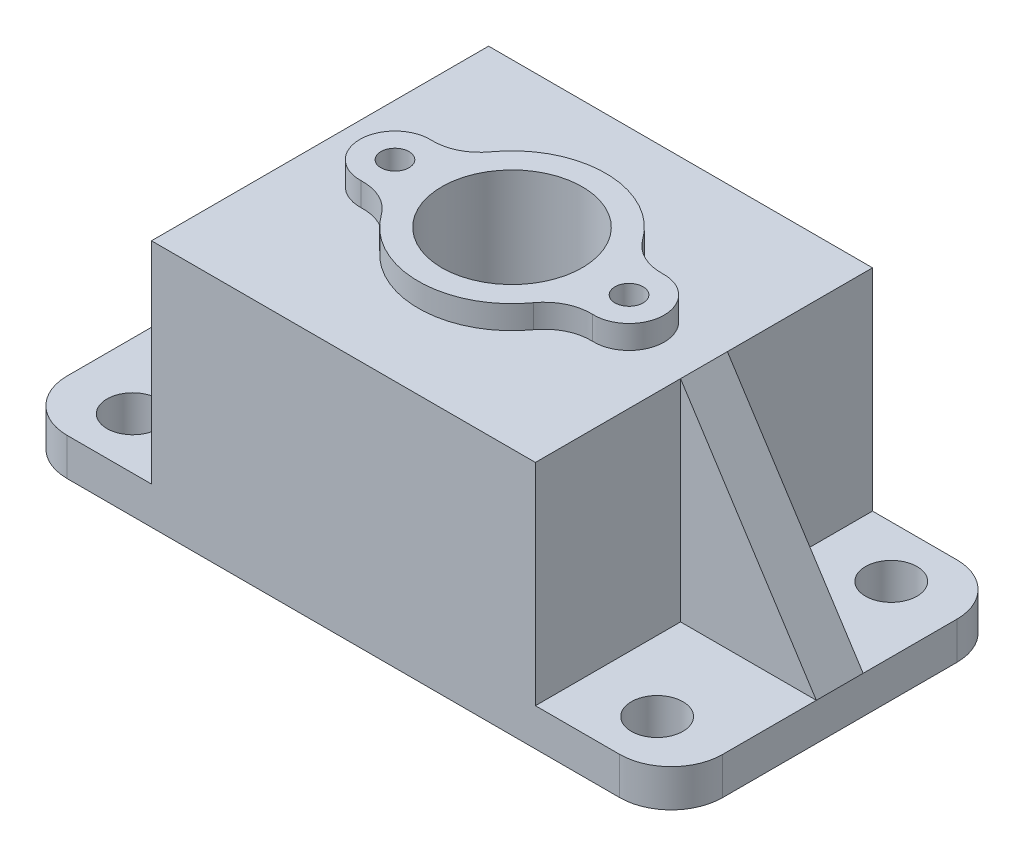
from build123d import *

# Parameters (mm, degrees)
SKETCH2_R           = 5.5
BOSS_EXTRUDE1_DEPTH = 8
SKETCH6_W           = 82
SKETCH6_H           = 72
BOSS_EXTRUDE4_DEPTH = 45
BOSS_EXTRUDE5_DEPTH = 5
CUT_EXTRUDE1_DEPTH  = 35
FILLET1_R           = 6
SKETCH9_R           = 15
SKETCH9_R_2         = 3
CUT_EXTRUDE2_DEPTH  = 98.775252493
RIB2_REACH          = 99.775
SKETCH11_WALL_W     = 251.085540362
SKETCH11_WALL_H     = 10


with BuildPart() as part:
    # Sketch2 → Boss-Extrude1 (new body)
    with BuildSketch(Plane(origin=(0, 0, 0), x_dir=(1, 0, 0), z_dir=(0, 1, 0))):
        with BuildLine():
            Line((-59, -36), (59, -36))
            ThreePointArc((59, -36), (66.778174593, -32.778174593), (70, -25))
            Line((70, -25), (70, 25))
            ThreePointArc((70, 25), (66.778174593, 32.778174593), (59, 36))
            Line((59, 36), (-59, 36))
            ThreePointArc((-59, 36), (-66.778174593, 32.778174593), (-70, 25))
            Line((-70, 25), (-70, -25))
            ThreePointArc((-70, -25), (-66.778174593, -32.778174593), (-59, -36))
        make_face()
        with Locations(Location((-56, 25, 0), (0, 0, 270))):
            Circle(SKETCH2_R, mode=Mode.SUBTRACT)
        with Locations(Location((-56, -25, 0), (0, 0, 270))):
            Circle(SKETCH2_R, mode=Mode.SUBTRACT)
        with Locations(Location((56, 25, 0), (0, 0, 270))):
            Circle(SKETCH2_R, mode=Mode.SUBTRACT)
        with Locations(Location((56, -25, 0), (0, 0, 270))):
            Circle(SKETCH2_R, mode=Mode.SUBTRACT)
    extrude(amount=BOSS_EXTRUDE1_DEPTH)

    # Sketch6 → Boss-Extrude4 (add)
    with BuildSketch(Plane(origin=(0, 8, 0), x_dir=(1, 0, 0), z_dir=(0, 1, 0))):
        Rectangle(SKETCH6_W, SKETCH6_H)
    extrude(amount=BOSS_EXTRUDE4_DEPTH)

    # Sketch7 → Boss-Extrude5 (add)
    with BuildSketch(Plane(origin=(0, 53, 0), x_dir=(1, 0, 0), z_dir=(0, 1, 0))):
        with BuildLine():
            ThreePointArc((-16.25, -11.659223816), (0, -20), (16.25, -11.659223816))
            ThreePointArc((16.25, -11.659223816), (19.968227615, -8.512179491), (24.732142857, -7.495215311))
            ThreePointArc((24.732142857, -7.495215311), (32.5, 0), (24.732142857, 7.495215311))
            ThreePointArc((24.732142857, 7.495215311), (19.968227615, 8.512179491), (16.25, 11.659223816))
            ThreePointArc((16.25, 11.659223816), (0, 20), (-16.25, 11.659223816))
            ThreePointArc((-16.25, 11.659223816), (-19.968227615, 8.512179491), (-24.732142857, 7.495215311))
            ThreePointArc((-24.732142857, 7.495215311), (-32.5, 0), (-24.732142857, -7.495215311))
            ThreePointArc((-24.732142857, -7.495215311), (-19.968227615, -8.512179491), (-16.25, -11.659223816))
        make_face()
    extrude(amount=BOSS_EXTRUDE5_DEPTH)

    # Sketch8 → Cut-Extrude1 (cut)
    with BuildSketch(Plane.XZ):
        with BuildLine():
            Line((-26.5, -31.5), (26.5, -31.5))
            ThreePointArc((26.5, -31.5), (30.742640687, -29.742640687), (32.5, -25.5))
            Line((32.5, -25.5), (32.5, 25.5))
            ThreePointArc((32.5, 25.5), (30.742640687, 29.742640687), (26.5, 31.5))
            Line((26.5, 31.5), (-26.5, 31.5))
            ThreePointArc((-26.5, 31.5), (-30.742640687, 29.742640687), (-32.5, 25.5))
            Line((-32.5, 25.5), (-32.5, -25.5))
            ThreePointArc((-32.5, -25.5), (-30.742640687, -29.742640687), (-26.5, -31.5))
        make_face()
    extrude(amount=-CUT_EXTRUDE1_DEPTH, mode=Mode.SUBTRACT)

    # Fillet1
    fillet1_edges = [part.edges().sort_by_distance(p)[0] for p in [
        (-30.742640687, 35, -29.742640687),
        (-32.5, 35, 0),
        (-30.742640687, 35, 29.742640687),
        (0, 35, 31.5),
        (30.742640687, 35, 29.742640687),
        (32.5, 35, 0),
        (30.742640687, 35, -29.742640687),
        (0, 35, -31.5),
    ]]
    fillet(fillet1_edges, radius=FILLET1_R)

    # Sketch9 → Cut-Extrude2 (cut, through all)
    with BuildSketch(Plane(origin=(0, 58, 0), x_dir=(1, 0, 0), z_dir=(0, 1, 0))):
        with Locations(Location((0, 0, 0), (0, 0, 270))):
            Circle(SKETCH9_R)
        with Locations(Location((25, 0, 0), (0, 0, 270))):
            Circle(SKETCH9_R_2)
        with Locations(Location((-25, 0, 0), (0, 0, 270))):
            Circle(SKETCH9_R_2)
    extrude(amount=-CUT_EXTRUDE2_DEPTH, mode=Mode.SUBTRACT)

    # Sketch11 wall → Rib2 (add, up to next)
    with BuildSketch(Plane(origin=(-55.5, 30.5, 0), x_dir=(-0.541701333727, -0.840571035094, 0), z_dir=(0.840571035094, -0.541701333727, 0)), mode=Mode.PRIVATE) as rib2_sk1:
        Rectangle(SKETCH11_WALL_W, SKETCH11_WALL_H)
    rib2_tool1 = extrude(rib2_sk1.sketch, amount=RIB2_REACH, mode=Mode.PRIVATE) - part.part
    rib2 = rib2_tool1.solids().sort_by_distance((-55.5, 30.5, 0))[0]
    add(rib2)

    # Mirror1: Rib2 across plane
    add(rib2.mirror(Plane(origin=(0, 0, 0), x_dir=(0, 0, 1), z_dir=(1, 0, 0))))


solid = part.part
